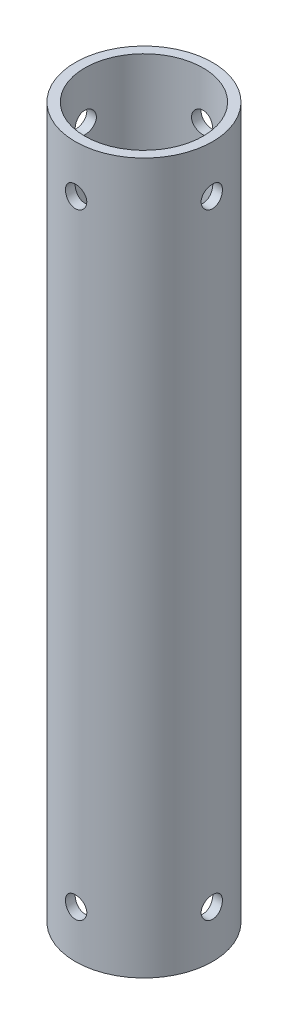
from build123d import *

# Parameters (mm, degrees)
SKETCH1_R           = 14.5
SKETCH1_R_2         = 12.5
BOSS_EXTRUDE1_DEPTH = 150
SKETCH2_R           = 2.25
CUT_EXTRUDE1_DEPTH  = 152.395178259
CIRPATTERN1_COUNT   = 4


with BuildPart() as part:
    # Sketch1 → Boss-Extrude1 (new body)
    with BuildSketch(Plane(origin=(0, 0, 0), x_dir=(1, 0, 0), z_dir=(0, 1, 0))):
        with Locations(Location((0, 0, 0), (0, 0, 270))):
            Circle(SKETCH1_R)
        with Locations(Location((0, 0, 0), (0, 0, 270))):
            Circle(SKETCH1_R_2, mode=Mode.SUBTRACT)
    extrude(amount=BOSS_EXTRUDE1_DEPTH)

    # Sketch2 → Cut-Extrude1 (cut, symmetric)
    with BuildSketch(Plane.XY):
        with Locations((0, 140)):
            Circle(SKETCH2_R)
        with Locations((0, 10)):
            Circle(SKETCH2_R)
    cut_extrude1 = extrude(amount=CUT_EXTRUDE1_DEPTH, both=True, mode=Mode.SUBTRACT)

    # CirPattern1: Cut-Extrude1 ×4 about axis
    cirpattern1_axis = Axis((0, 150, 0), (0, -1, 0))
    for i in range(1, CIRPATTERN1_COUNT):
        add(cut_extrude1.rotate(cirpattern1_axis, i * 360 / CIRPATTERN1_COUNT), mode=Mode.SUBTRACT)


solid = part.part
